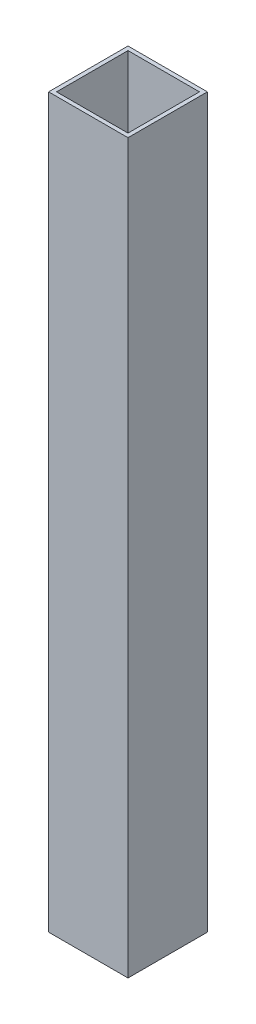
from build123d import *

# Parameters (mm, degrees)
SKETCH1_W           = 30
SKETCH1_H           = 30
SKETCH1_W_2         = 27
SKETCH1_H_2         = 27
BOSS_EXTRUDE1_DEPTH = 275


with BuildPart() as part:
    # Sketch1 → Boss-Extrude1 (new body)
    with BuildSketch(Plane(origin=(0, 0, 0), x_dir=(1, 0, 0), z_dir=(0, 1, 0))):
        with Locations((15, -15)):
            Rectangle(SKETCH1_W, SKETCH1_H)
        with Locations((15, -15)):
            Rectangle(SKETCH1_W_2, SKETCH1_H_2, mode=Mode.SUBTRACT)
    extrude(amount=BOSS_EXTRUDE1_DEPTH)


solid = part.part
